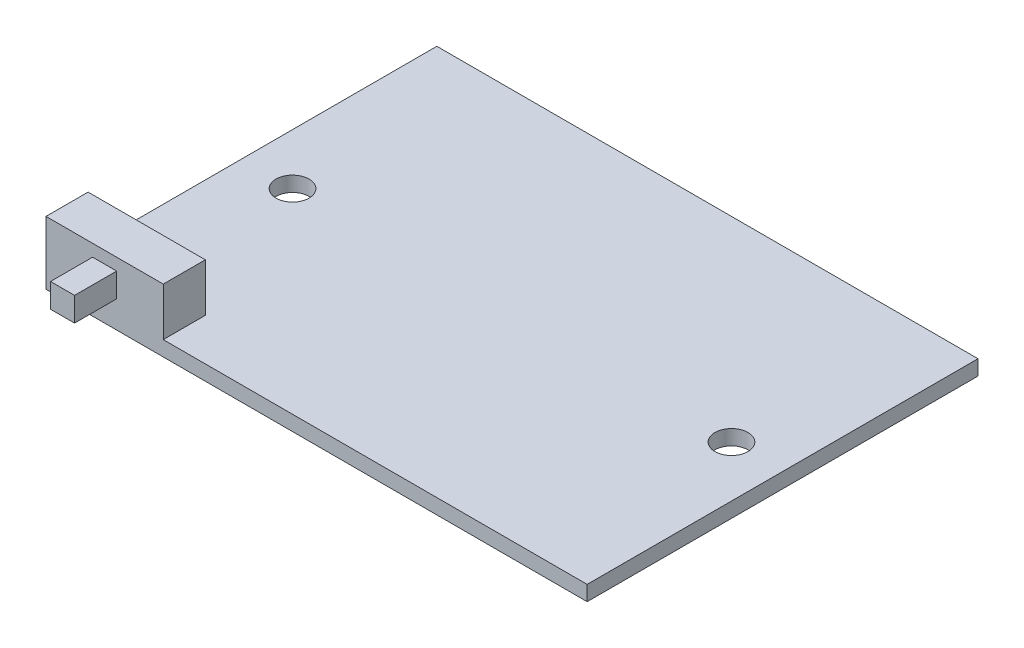
from build123d import *

# Parameters (mm, degrees)
SKETCH1_W           = 45.72
SKETCH1_H           = 33.02
SKETCH1_R           = 1.397
BOSS_EXTRUDE1_DEPTH = 1.27
SKETCH3_W           = 9.906
SKETCH3_H           = 3.556
BOSS_EXTRUDE2_DEPTH = 4.064
SKETCH4_W           = 2.032
SKETCH4_H           = 2.032
BOSS_EXTRUDE3_DEPTH = 3.556


with BuildPart() as part:
    # Sketch1 → Boss-Extrude1 (new body)
    with BuildSketch(Plane(origin=(0, 0, 0), x_dir=(1, 0, 0), z_dir=(0, 1, 0))):
        Rectangle(SKETCH1_W, SKETCH1_H)
        with Locations(Location((-18.542, 0, 0), (0, 0, 270))):
            Circle(SKETCH1_R, mode=Mode.SUBTRACT)
        with Locations(Location((18.542, 0, 0), (0, 0, 270))):
            Circle(SKETCH1_R, mode=Mode.SUBTRACT)
    extrude(amount=BOSS_EXTRUDE1_DEPTH)

    # Sketch3 → Boss-Extrude2 (add)
    with BuildSketch(Plane(origin=(0, 1.27, 0), x_dir=(1, 0, 0), z_dir=(0, 1, 0))):
        with Locations((-17.907, -14.732)):
            Rectangle(SKETCH3_W, SKETCH3_H)
    extrude(amount=BOSS_EXTRUDE2_DEPTH)

    # Sketch4 → Boss-Extrude3 (add)
    with BuildSketch(Plane.XY.offset(16.51)):
        with Locations((-17.907, 3.302)):
            Rectangle(SKETCH4_W, SKETCH4_H)
    extrude(amount=BOSS_EXTRUDE3_DEPTH)


solid = part.part
